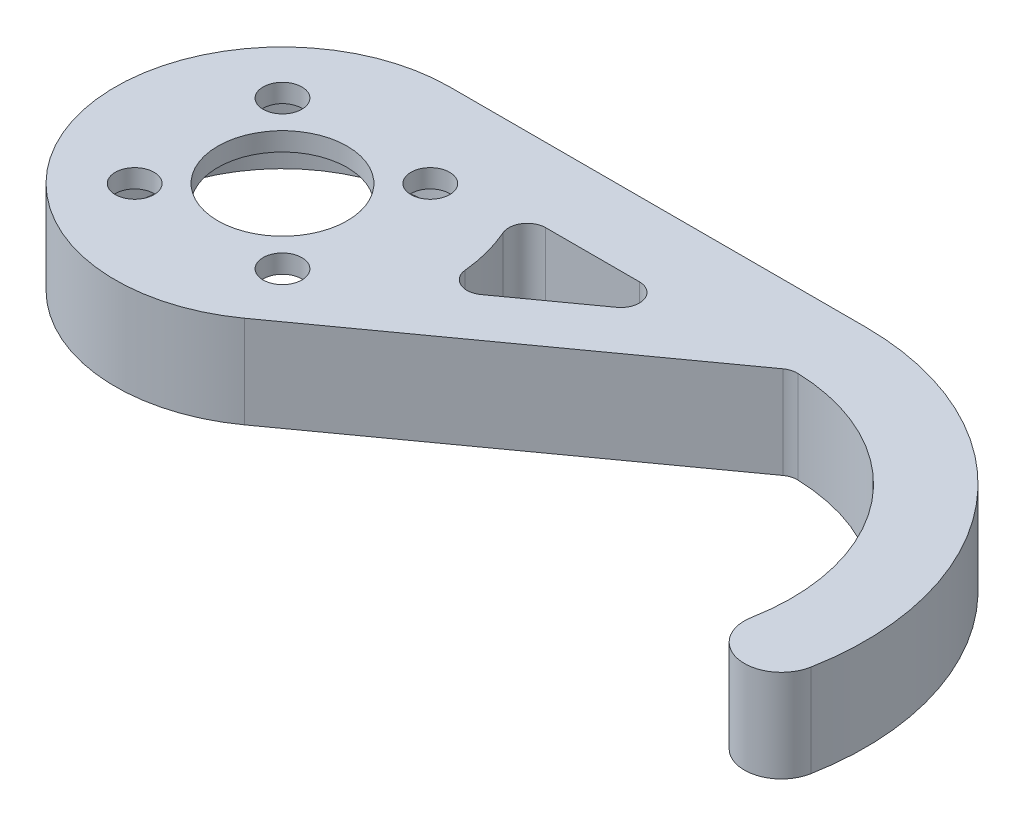
from build123d import *

# Parameters (mm, degrees)
SKETCH1_R           = 2.1
SKETCH1_R_2         = 7
BOSS_EXTRUDE1_DEPTH = 10
FILLET1_R           = 2
SKETCH2_R           = 16.1
CUT_EXTRUDE1_DEPTH  = 8


with BuildPart() as part:
    # Sketch1 → Boss-Extrude1 (new body)
    with BuildSketch(Plane(origin=(0, 0, 0), x_dir=(1, 0, 0), z_dir=(0, 1, 0))):
        with BuildLine():
            Line((0, 18.1), (45, 18.1))
            ThreePointArc((45, 18.1), (67.641132128, 7.472867216), (73.932044859, -16.734182011))
            ThreePointArc((73.932044859, -16.734182011), (69.265817989, -19.932044859), (66.067955141, -15.265817989))
            ThreePointArc((66.067955141, -15.265817989), (61.486990751, 2.361454112), (45, 10.1))
            Line((45, 10.1), (10.576879596, -14.68807741))
            ThreePointArc((10.576879596, -14.68807741), (-17.225913635, -5.556788591), (0, 18.1))
        make_face()
        with Locations(Location((-8, 8, 0), (0, 0, 270))):
            Circle(SKETCH1_R, mode=Mode.SUBTRACT)
        with Locations(Location((8, 8, 0), (0, 0, 270))):
            Circle(SKETCH1_R, mode=Mode.SUBTRACT)
        with Locations(Location((8, -8, 0), (0, 0, 270))):
            Circle(SKETCH1_R, mode=Mode.SUBTRACT)
        with Locations(Location((-8, -8, 0), (0, 0, 270))):
            Circle(SKETCH1_R, mode=Mode.SUBTRACT)
        with Locations(Location((0, 0, 0), (0, 0, 270))):
            Circle(SKETCH1_R_2, mode=Mode.SUBTRACT)
        with BuildLine():
            Line((15.019986684, 10.1), (34.732321427, 10.1))
            Line((34.732321427, 10.1), (17.994323759, -1.953026484))
            ThreePointArc((17.994323759, -1.953026484), (17.572849381, 4.336469143), (15.019986684, 10.1))
        make_face(mode=Mode.SUBTRACT)
    extrude(amount=BOSS_EXTRUDE1_DEPTH)

    # Fillet1
    fillet1_edges = [part.edges().sort_by_distance(p)[0] for p in [
        (45, 5, -10.1),
        (15.019986684, 5, -10.1),
        (17.994323759, 5, 1.953026484),
        (34.732321427, 5, -10.1),
    ]]
    fillet(fillet1_edges, radius=FILLET1_R)

    # Sketch2 → Cut-Extrude1 (cut)
    with BuildSketch(Plane.XZ):
        with Locations(Location((0, 0, 0), (0, 0, 270))):
            Circle(SKETCH2_R)
    extrude(amount=-CUT_EXTRUDE1_DEPTH, mode=Mode.SUBTRACT)


solid = part.part
